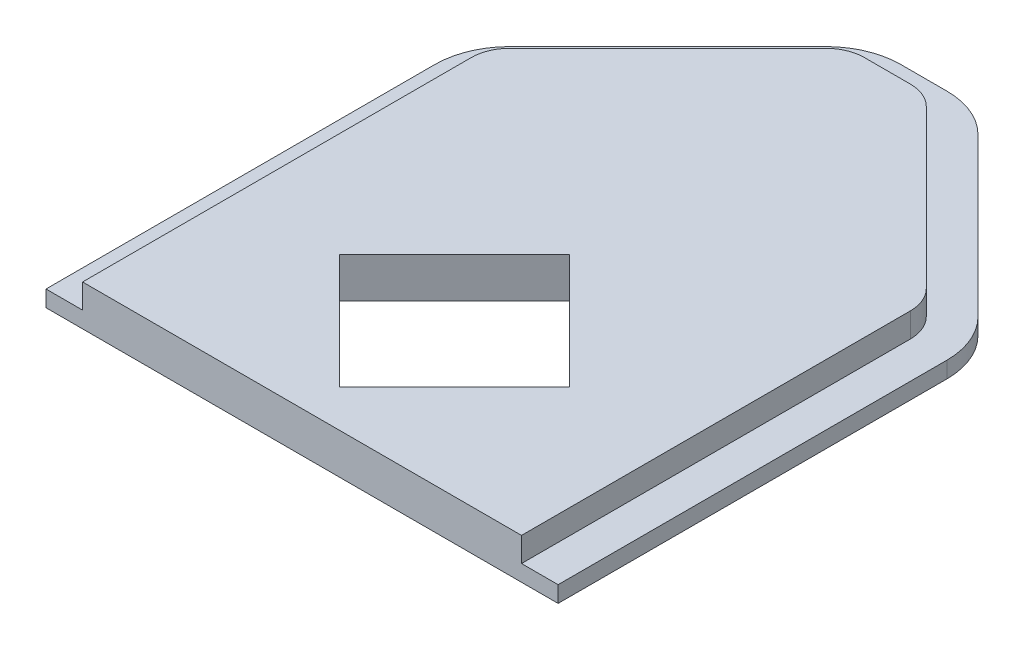
from build123d import *

# Parameters (mm, degrees)
BOSS_EXTRUDE1_DEPTH = 2
FILLET1_R           = 1.9
BOSS_EXTRUDE2_DEPTH = 0.8
CUT_EXTRUDE1_REACH  = 35.153


with BuildPart() as part:
    # Sketch1 → Boss-Extrude1 (new body)
    with BuildSketch(Plane(origin=(0, 0, 0), x_dir=(1, 0, 0), z_dir=(0, 1, 0))):
        Polygon((-10.8, 0), (-10.8, 19.917157288), (-1.917157288, 28.8), (1.917157288, 28.8), (10.8, 19.917157288), (10.8, 0), align=None)
    extrude(amount=BOSS_EXTRUDE1_DEPTH)

    # Fillet1
    fillet1_edges = [part.edges().sort_by_distance(p)[0] for p in [
        (-10.8, 1, -19.917157288),
        (-1.917157288, 1, -28.8),
        (1.917157288, 1, -28.8),
        (10.8, 1, -19.917157288),
    ]]
    fillet(fillet1_edges, radius=FILLET1_R)

    # Sketch2 → Boss-Extrude2 (add)
    with BuildSketch(Plane.XZ):
        with BuildLine():
            Line((12.6, 0), (-12.6, 0))
            Line((-12.6, 0), (-12.6, -19.130151519))
            ThreePointArc((-12.6, -19.130151519), (-12.31835427, -20.546080219), (-11.51629509, -21.746446609))
            Line((-11.51629509, -21.746446609), (-3.746446609, -29.51629509))
            ThreePointArc((-3.746446609, -29.51629509), (-2.546080219, -30.31835427), (-1.130151519, -30.6))
            Line((-1.130151519, -30.6), (1.130151519, -30.6))
            ThreePointArc((1.130151519, -30.6), (2.546080219, -30.31835427), (3.746446609, -29.51629509))
            Line((3.746446609, -29.51629509), (11.51629509, -21.746446609))
            ThreePointArc((11.51629509, -21.746446609), (12.31835427, -20.546080219), (12.6, -19.130151519))
            Line((12.6, -19.130151519), (12.6, 0))
        make_face()
    extrude(amount=-BOSS_EXTRUDE2_DEPTH)

    # Sketch3 → Cut-Extrude1 (cut, up to next)
    with BuildSketch(Plane(origin=(0, 2, 0), x_dir=(1, 0, 0), z_dir=(0, 1, 0)), mode=Mode.PRIVATE) as cut_extrude1_sk1:
        Polygon((5.656854249, 7.5), (0, 13.156854249), (-5.656854249, 7.5), (0, 1.843145751), align=None)
    cut_extrude1_tool1 = extrude(cut_extrude1_sk1.sketch, amount=-CUT_EXTRUDE1_REACH, mode=Mode.PRIVATE) & part.part
    add(cut_extrude1_tool1.solids().sort_by_distance((0, 2, -7.5))[0], mode=Mode.SUBTRACT)


solid = part.part
